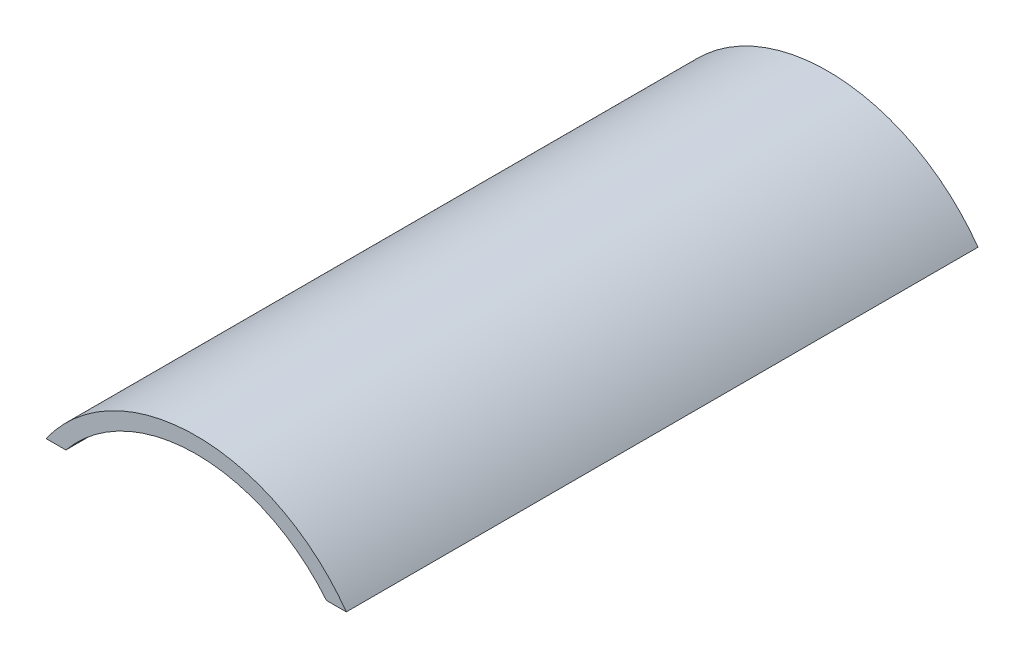
from build123d import *

# Parameters (mm, degrees)
BOSS_EXTRUDE1_DEPTH = 60


with BuildPart() as part:
    # Sketch1 → Boss-Extrude1 (new body)
    with BuildSketch(Plane.XY):
        with BuildLine():
            Line((-12.376520215, 10.140105885), (-14.262827652, 10.140105885))
            ThreePointArc((-14.262827652, 10.140105885), (0, 17.5), (14.262827652, 10.140105885))
            Line((14.262827652, 10.140105885), (12.376520215, 10.140105885))
            ThreePointArc((12.376520215, 10.140105885), (0, 16), (-12.376520215, 10.140105885))
        make_face()
    extrude(amount=BOSS_EXTRUDE1_DEPTH)


solid = part.part
